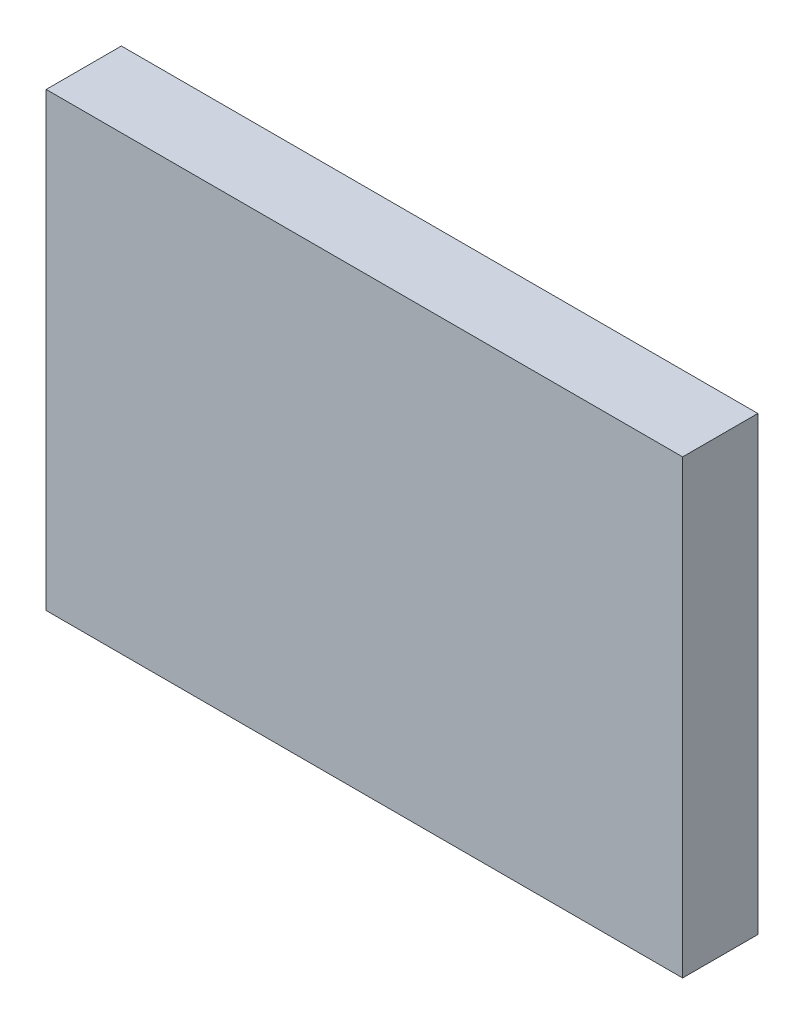
from build123d import *

# Parameters (mm, degrees)
ESQUISSE1_W        = 110
ESQUISSE1_H        = 78
BOSS_EXTRU_1_DEPTH = 13


with BuildPart() as part:
    # Esquisse1 → Boss.-Extru.1 (new body)
    with BuildSketch(Plane.XY):
        with Locations((55, 39)):
            Rectangle(ESQUISSE1_W, ESQUISSE1_H)
    extrude(amount=BOSS_EXTRU_1_DEPTH)


solid = part.part
